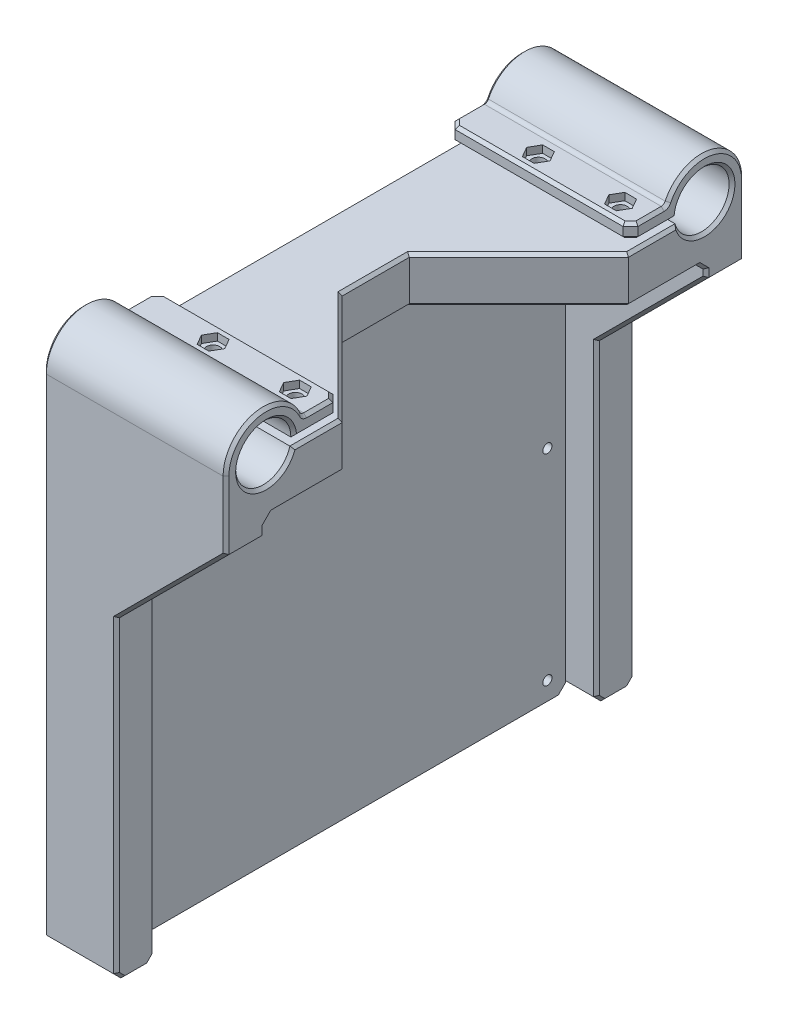
from build123d import *

# Parameters (mm, degrees)
SKETCH1_R                                       = 11
SKETCH1_R_2                                     = 7.55
BOSS_EXTRUDE1_DEPTH                             = 50
BOSS_EXTRUDE1_2_DEPTH                           = 50
BOSS_EXTRUDE3_DEPTH                             = 50
CUT_EXTRUDE3_START                              = -6
SKETCH12_W                                      = 120.8
SKETCH12_H                                      = 120.8
CUT_EXTRUDE3_DEPTH                              = 44
CSK_FOR_M3_FLAT_HEAD_MACHINE_SCREW1_D           = 3.6
CSK_FOR_M3_FLAT_HEAD_MACHINE_SCREW1_CSINK_D     = 6.3
CSK_FOR_M3_FLAT_HEAD_MACHINE_SCREW1_CSINK_ANGLE = 90
CUT_EXTRUDE4_DEPTH                              = 12.6
SKETCH14_W                                      = 120
SKETCH14_H                                      = 120
BOSS_EXTRUDE7_DEPTH                             = 6
CHAMFER2_SIZE                                   = 2
SKETCH16_W                                      = 1.25
SKETCH16_H                                      = 12
M3X0_5_TAPPED_HOLE1_AT_2_COUNT                  = 2
M3X0_5_TAPPED_HOLE1_AT_2_PITCH                  = 55
M3X0_5_TAPPED_HOLE1_AT_3_COUNT                  = 2
M3X0_5_TAPPED_HOLE1_AT_3_PITCH                  = 110
M3X0_5_TAPPED_HOLE1_AT_4_COUNT                  = 2
M3X0_5_TAPPED_HOLE1_AT_4_PITCH                  = 55
M3X0_5_TAPPED_HOLE1_AT_5_COUNT                  = 2
M3X0_5_TAPPED_HOLE1_AT_5_PITCH                  = 110
M3X0_5_TAPPED_HOLE1_AT_6_COUNT                  = 2
M3X0_5_TAPPED_HOLE1_AT_6_PITCH                  = 122.983738762
M3X0_5_TAPPED_HOLE1_AT_7_COUNT                  = 2
M3X0_5_TAPPED_HOLE1_AT_7_PITCH                  = 155.563491861
CUT_EXTRUDE5_DEPTH                              = 195.912698406
CUT_EXTRUDE5_DEPTH_BACK                         = 195.912698406
CUT_EXTRUDE6_DEPTH                              = 161.517911773
CUT_EXTRUDE6_DEPTH_BACK                         = 161.517911773
SKETCH19_W                                      = 105.439436824
SKETCH19_H                                      = 2
SKETCH20_W                                      = 10
SKETCH20_H                                      = 4
BOSS_EXTRUDE9_DEPTH                             = 50
CUT_EXTRUDE7_DEPTH                              = 2
CSK_FOR_M3_FLAT_HEAD_MACHINE_SCREW2_AT_2_COUNT  = 2
CSK_FOR_M3_FLAT_HEAD_MACHINE_SCREW2_AT_2_PITCH  = 22.5
CSK_FOR_M3_FLAT_HEAD_MACHINE_SCREW2_AT_3_COUNT  = 2
CSK_FOR_M3_FLAT_HEAD_MACHINE_SCREW2_AT_3_PITCH  = 89.056098468
CSK_FOR_M3_FLAT_HEAD_MACHINE_SCREW2_AT_4_COUNT  = 2
CSK_FOR_M3_FLAT_HEAD_MACHINE_SCREW2_AT_4_PITCH  = 91.854442867
CHAMFER6_SIZE                                   = 2
CHAMFER3_SIZE                                   = 2
FILLET2_R                                       = 1.2
CHAMFER5_SIZE                                   = 0.8


with BuildPart() as part:
    # Sketch1 → Boss-Extrude1 (new body)
    with BuildSketch(Plane(origin=(0, 0, 0), x_dir=(0, 0, -1), z_dir=(1, 0, 0))):
        with Locations((-60, 0)):
            Circle(SKETCH1_R)
        with Locations((-60, 0)):
            Circle(SKETCH1_R_2, mode=Mode.SUBTRACT)
    extrude(amount=BOSS_EXTRUDE1_DEPTH)



with BuildPart() as body_2:
    # Sketch1 → Boss-Extrude1 2 (new body)
    with BuildSketch(Plane(origin=(0, 0, 0), x_dir=(0, 0, -1), z_dir=(1, 0, 0))):
        with Locations((60, 0)):
            Circle(SKETCH1_R)
        with Locations((60, 0)):
            Circle(SKETCH1_R_2, mode=Mode.SUBTRACT)
    extrude(amount=BOSS_EXTRUDE1_2_DEPTH)


with BuildPart() as part_1:
    add(part.part)

    add(body_2.part)  # Boss-Extrude3 merges body 2
    # Sketch4 → Boss-Extrude3 (add)
    with BuildSketch(Plane(origin=(0, 0, 0), x_dir=(0, 0, -1), z_dir=(1, 0, 0))):
        with BuildLine():
            Line((-50, -135), (-50, -25))
            Line((-50, -25), (50, -25))
            Line((50, -25), (50, -135))
            Line((50, -135), (71, -135))
            Line((71, -135), (71, 0))
            ThreePointArc((71, 0), (61.004193186, -10.954067557), (49.183346174, -2))
            Line((49.183346174, -2), (-49.183346174, -2))
            ThreePointArc((-49.183346174, -2), (-61.004193186, -10.954067557), (-71, 0))
            Line((-71, 0), (-71, -135))
            Line((-71, -135), (-50, -135))
        make_face()
    extrude(amount=BOSS_EXTRUDE3_DEPTH)

    # Sketch12 → Cut-Extrude3 (cut)
    with BuildSketch(Plane.ZY.offset(CUT_EXTRUDE3_START)):
        with Locations((0, -75)):
            Rectangle(SKETCH12_W, SKETCH12_H)
    extrude(amount=-CUT_EXTRUDE3_DEPTH, mode=Mode.SUBTRACT)

    # CSK for M3 Flat Head Machine Screw1 (through all)
    with Locations(Plane.ZY):
        with Locations((-55, -130), (-55, -75), (-55, -20), (0, -20), (55, -20), (55, -75), (55, -130), (0, -75)):
            CounterSinkHole(CSK_FOR_M3_FLAT_HEAD_MACHINE_SCREW1_D / 2, CSK_FOR_M3_FLAT_HEAD_MACHINE_SCREW1_CSINK_D / 2, counter_sink_angle=CSK_FOR_M3_FLAT_HEAD_MACHINE_SCREW1_CSINK_ANGLE)

    # Sketch13 → Cut-Extrude4 (cut)
    with BuildSketch(Plane(origin=(0, -2, 0), x_dir=(1, 0, 0), z_dir=(0, 1, 0))):
        Polygon((50, 39.183346174), (20, 9.183346174), (20, -9.183346174), (50, -39.183346174), align=None)
    extrude(amount=-CUT_EXTRUDE4_DEPTH, mode=Mode.SUBTRACT)

    # Sketch17 → Cut-Extrude5 (cut, two sides: drawn at the far end of the back side and taken through both)
    with BuildSketch(Plane.XY.offset(-60.4).offset(-CUT_EXTRUDE5_DEPTH_BACK)):
        Polygon((50, -18.6), (20, -48.6), (20, -135), (50, -135), align=None)
    extrude(amount=CUT_EXTRUDE5_DEPTH + CUT_EXTRUDE5_DEPTH_BACK, mode=Mode.SUBTRACT)

    # Sketch19 → Cut-Extrude6 (cut, two sides: drawn at the far end of the back side and taken through both)
    with BuildSketch(Plane(origin=(50, 0, 0), x_dir=(0, 0, -1), z_dir=(1, 0, 0)).offset(-CUT_EXTRUDE6_DEPTH_BACK)):
        with Locations((0, -1)):
            Rectangle(SKETCH19_W, SKETCH19_H)
    extrude(amount=CUT_EXTRUDE6_DEPTH + CUT_EXTRUDE6_DEPTH_BACK, mode=Mode.SUBTRACT)

    # Sketch20 → Boss-Extrude9 (add)
    with BuildSketch(Plane(origin=(50, 0, 0), x_dir=(0, 0, -1), z_dir=(1, 0, 0))):
        with Locations((-44.753049234, 2)):
            Rectangle(SKETCH20_W, SKETCH20_H)
        with Locations((44.753049234, 2)):
            Rectangle(SKETCH20_W, SKETCH20_H)
    extrude(amount=-BOSS_EXTRUDE9_DEPTH)

    # Sketch21 → Cut-Extrude7 (cut)
    with BuildSketch(Plane(origin=(0, 4, 0), x_dir=(1, 0, 0), z_dir=(0, 1, 0))):
        Polygon((45.704293994, 44.528049234), (44.102146997, 47.303049234), (40.897853003, 47.303049234), (39.295706006, 44.528049234), (40.897853003, 41.753049234), (44.102146997, 41.753049234), align=None)
        Polygon((23.204293994, 44.528049234), (21.602146997, 47.303049234), (18.397853003, 47.303049234), (16.795706006, 44.528049234), (18.397853003, 41.753049234), (21.602146997, 41.753049234), align=None)
        Polygon((23.204293994, -44.528049234), (21.602146997, -41.753049234), (18.397853003, -41.753049234), (16.795706006, -44.528049234), (18.397853003, -47.303049234), (21.602146997, -47.303049234), align=None)
        Polygon((45.704293994, -44.528049234), (44.102146997, -41.753049234), (40.897853003, -41.753049234), (39.295706006, -44.528049234), (40.897853003, -47.303049234), (44.102146997, -47.303049234), align=None)
    extrude(amount=-CUT_EXTRUDE7_DEPTH, mode=Mode.SUBTRACT)

    # Sketch24 → CSK for M3 Flat Head Machine Screw2 (revolve, cut)
    with BuildSketch(Plane(origin=(20, -14.6, -44.528049234), x_dir=(0, 0, -1), z_dir=(1, 0, 0))):
        Polygon((0, 0), (0, 25.6), (1.8, 25.6), (1.8, 1.35), (3.15, 0), align=None)
    csk_for_m3_flat_head_machine_screw2 = revolve(axis=Axis((20, -20.95, -44.528049234), (0, 1, 0)), mode=Mode.SUBTRACT)

    # CSK for M3 Flat Head Machine Screw2 at 2: CSK for M3 Flat Head Machine Screw2 ×2
    with Locations(*[(i * CSK_FOR_M3_FLAT_HEAD_MACHINE_SCREW2_AT_2_PITCH, 0, 0) for i in range(1, CSK_FOR_M3_FLAT_HEAD_MACHINE_SCREW2_AT_2_COUNT)]):
        add(csk_for_m3_flat_head_machine_screw2, mode=Mode.SUBTRACT)

    # CSK for M3 Flat Head Machine Screw2 at 3: CSK for M3 Flat Head Machine Screw2 ×2
    with Locations(*[(0, 0, i * CSK_FOR_M3_FLAT_HEAD_MACHINE_SCREW2_AT_3_PITCH) for i in range(1, CSK_FOR_M3_FLAT_HEAD_MACHINE_SCREW2_AT_3_COUNT)]):
        add(csk_for_m3_flat_head_machine_screw2, mode=Mode.SUBTRACT)

    # CSK for M3 Flat Head Machine Screw2 at 4: CSK for M3 Flat Head Machine Screw2 ×2
    with Locations(*[Vector(0.24495276763744586, 0, 0.9695350130999683) * (i * CSK_FOR_M3_FLAT_HEAD_MACHINE_SCREW2_AT_4_PITCH) for i in range(1, CSK_FOR_M3_FLAT_HEAD_MACHINE_SCREW2_AT_4_COUNT)]):
        add(csk_for_m3_flat_head_machine_screw2, mode=Mode.SUBTRACT)

    # Chamfer6
    chamfer6_edges = [part_1.edges().sort_by_distance(p)[0] for p in [
        (50, 2, 39.753049234),
        (0, 2, 39.753049234),
        (50, 2, -39.753049234),
        (0, 2, -39.753049234),
    ]]
    chamfer(chamfer6_edges, length=CHAMFER6_SIZE)

    # Chamfer3
    chamfer3_edges = [part_1.edges().sort_by_distance(p)[0] for p in [
        (13, -135, -60.4),
        (10, -135, 71),
        (10, -135, -71),
        (3, -25, -50),
        (3, -135, -50),
        (3, -25, 50),
        (3, -135, 50),
        (13, -135, 60.4),
        (28, -14.6, 60.4),
        (28, -14.6, -60.4),
    ]]
    chamfer(chamfer3_edges, length=CHAMFER3_SIZE)

    # Fillet2
    fillet2_edges = [part_1.edges().sort_by_distance(p)[0] for p in [
        (25, 4, 49.753049234),
        (25, 4, -49.753049234),
    ]]
    fillet(fillet2_edges, radius=FILLET2_R)

    # Chamfer5
    chamfer5_edges = [part_1.edges().sort_by_distance(p)[0] for p in [
        (50, -14.6, -48.791673087),
        (50, -2, 45.951532293),
        (35, -2, -24.183346174),
        (0, -2, 0),
        (20, -2, 0),
        (35, -2, 24.183346174),
        (35, -14.6, 24.183346174),
        (20, -14.6, 0),
        (35, -14.6, -24.183346174),
        (0, -66.5, 71),
        (50, -17.6, 60.4),
        (35, -33.6, 60.4),
        (20, -90.8, 60.4),
        (50, -9.3, -71),
        (20, -90.8, -71),
        (35, -33.6, -60.4),
        (35, -33.6, -71),
        (35, -33.6, 71),
        (20, -90.8, 71),
        (50, -2, -45.951532293),
        (50, -9.3, 71),
        (50, 7.55, -60),
        (0, 7.55, -60),
        (0, 0, -47.101524617),
        (50, 0, -47.101524617),
        (0, 10.734486998, -62.402246633),
        (0, 1.009052529, 67.482266568),
        (50, 1.009052529, 67.482266568),
        (25, 0, -39.753049234),
        (1, 0, -40.753049234),
        (49, 0, -40.753049234),
        (25, 4, -39.753049234),
        (0, 4, -45.358372752),
        (1, 4, -40.753049234),
        (49, 4, -40.753049234),
        (50, 0, 47.101524617),
        (50, 4, 45.358372752),
        (25, 4, 39.753049234),
        (1, 4, 40.753049234),
        (49, 4, 40.753049234),
        (25, 0, 39.753049234),
        (0, 0, 47.101524617),
        (1, 0, 40.753049234),
        (49, 0, 40.753049234),
        (0, -66.5, -71),
        (0, -135, -60.5),
        (0, -80, -50),
        (0, -25, 0),
        (0, -80, 50),
        (0, -135, 60.5),
        (0, -134, -51),
        (0, -134, 51),
        (0, -134, 70),
        (0, -134, -70),
        (20, -135, -65.7),
        (20, -90.8, -60.4),
        (20, -134, -61.4),
        (20, -134, -70),
        (50, -17.6, -60.4),
        (20, -135, 65.7),
        (6, -135, 57.2),
        (20, -134, 61.4),
        (20, -134, 70),
        (6, -80, 50),
        (6, -25, 0),
        (6, -80, -50),
        (6, -134, -51),
        (6, -134, 51),
        (50, -14.6, 48.791673087),
        (0, -26, 49),
        (6, -26, 49),
        (0, -26, -49),
        (6, -26, -49),
        (50, -15.6, -59.4),
        (50, -15.6, 59.4),
        (0, 4, 45.358372752),
        (50, 10.734486998, 62.402246633),
        (0, 10.734486998, 62.402246633),
        (50, 4, -45.358372752),
        (50, 4.186646535, 49.606436307),
        (0, 4.186646535, 49.606436307),
        (6, -135, -57.2),
        (50, 4.186646535, -49.606436307),
        (0, 4.186646535, -49.606436307),
        (50, 10.734486998, -62.402246633),
    ]]
    chamfer(chamfer5_edges, length=CHAMFER5_SIZE)


with BuildPart() as body_2_2:
    # Sketch14 → Boss-Extrude7 (new body)
    with BuildSketch(Plane(origin=(6, 0, 0), x_dir=(0, 0, -1), z_dir=(1, 0, 0))):
        with Locations((0, -75)):
            Rectangle(SKETCH14_W, SKETCH14_H)
    extrude(amount=BOSS_EXTRUDE7_DEPTH)

    # Chamfer2
    chamfer2_edges = [body_2_2.edges().sort_by_distance(p)[0] for p in [
        (9, -15, 60),
        (9, -15, -60),
        (9, -135, -60),
        (9, -135, 60),
    ]]
    chamfer(chamfer2_edges, length=CHAMFER2_SIZE)

    # Sketch16 → M3x0.5 Tapped Hole1 (revolve, cut)
    with BuildSketch(Plane(origin=(12, -20, 55), x_dir=(0, 0, -1), z_dir=(0, 1, 0))):
        with Locations((0.625, 6)):
            Rectangle(SKETCH16_W, SKETCH16_H)
    m3x0_5_tapped_hole1 = revolve(axis=Axis((18.35, -20, 55), (-1, 0, 0)), mode=Mode.SUBTRACT)

    # M3x0.5 Tapped Hole1 at 2: M3x0.5 Tapped Hole1 ×2
    with Locations(*[(0, -i * M3X0_5_TAPPED_HOLE1_AT_2_PITCH, 0) for i in range(1, M3X0_5_TAPPED_HOLE1_AT_2_COUNT)]):
        add(m3x0_5_tapped_hole1, mode=Mode.SUBTRACT)

    # M3x0.5 Tapped Hole1 at 3: M3x0.5 Tapped Hole1 ×2
    with Locations(*[(0, -i * M3X0_5_TAPPED_HOLE1_AT_3_PITCH, 0) for i in range(1, M3X0_5_TAPPED_HOLE1_AT_3_COUNT)]):
        add(m3x0_5_tapped_hole1, mode=Mode.SUBTRACT)

    # M3x0.5 Tapped Hole1 at 4: M3x0.5 Tapped Hole1 ×2
    with Locations(*[(0, 0, -i * M3X0_5_TAPPED_HOLE1_AT_4_PITCH) for i in range(1, M3X0_5_TAPPED_HOLE1_AT_4_COUNT)]):
        add(m3x0_5_tapped_hole1, mode=Mode.SUBTRACT)

    # M3x0.5 Tapped Hole1 at 5: M3x0.5 Tapped Hole1 ×2
    with Locations(*[(0, 0, -i * M3X0_5_TAPPED_HOLE1_AT_5_PITCH) for i in range(1, M3X0_5_TAPPED_HOLE1_AT_5_COUNT)]):
        add(m3x0_5_tapped_hole1, mode=Mode.SUBTRACT)

    # M3x0.5 Tapped Hole1 at 6: M3x0.5 Tapped Hole1 ×2
    with Locations(*[Vector(0, -0.447213595499958, -0.894427190999916) * (i * M3X0_5_TAPPED_HOLE1_AT_6_PITCH) for i in range(1, M3X0_5_TAPPED_HOLE1_AT_6_COUNT)]):
        add(m3x0_5_tapped_hole1, mode=Mode.SUBTRACT)

    # M3x0.5 Tapped Hole1 at 7: M3x0.5 Tapped Hole1 ×2
    with Locations(*[Vector(0, -0.7071067811865476, -0.7071067811865476) * (i * M3X0_5_TAPPED_HOLE1_AT_7_PITCH) for i in range(1, M3X0_5_TAPPED_HOLE1_AT_7_COUNT)]):
        add(m3x0_5_tapped_hole1, mode=Mode.SUBTRACT)


solid = Compound([part_1.part, body_2_2.part])
